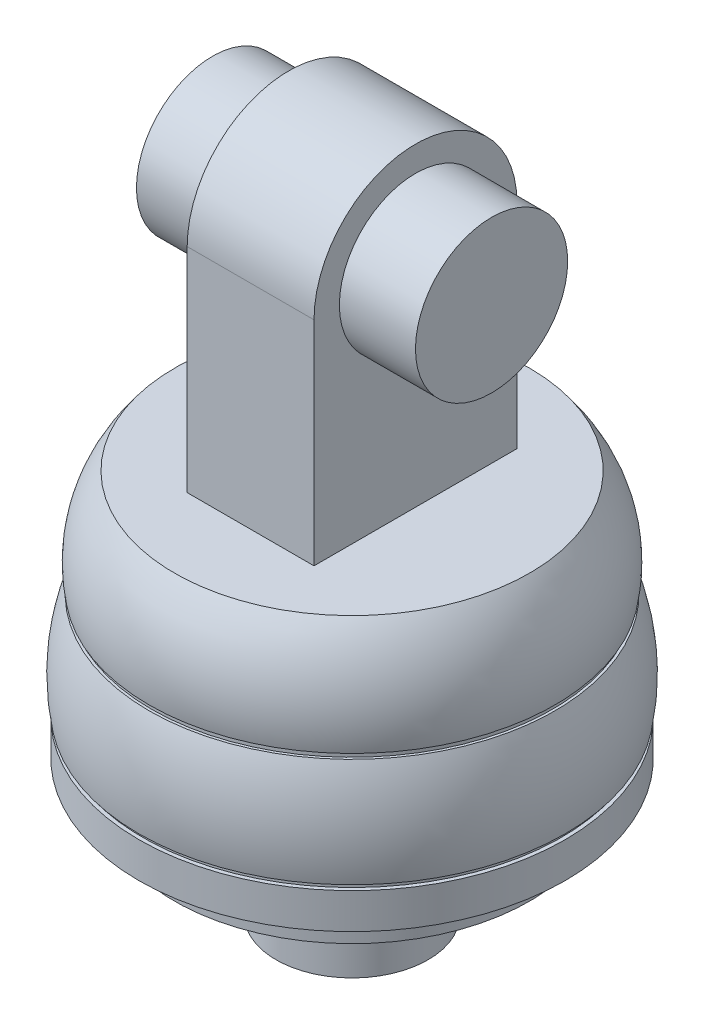
from build123d import *

# Parameters (mm, degrees)
SKETCH2_R           = 39.5
BOSS_EXTRUDE1_DEPTH = 1
SKETCH4_R           = 41.25
BOSS_EXTRUDE2_DEPTH = 1
SKETCH5_R           = 42
BOSS_EXTRUDE3_DEPTH = 7
SKETCH6_R           = 35
BOSS_EXTRUDE4_DEPTH = 7
SKETCH7_R           = 15
BOSS_EXTRUDE5_DEPTH = 20
SKETCH8_W           = 25
SKETCH8_H           = 40
BOSS_EXTRUDE6_DEPTH = 42
BOSS_EXTRUDE7_DEPTH = 12.5
SKETCH11_R          = 15
BOSS_EXTRUDE8_DEPTH = 15
SKETCH12_R          = 15
BOSS_EXTRUDE9_DEPTH = 15


with BuildPart() as part:
    # Sketch1 → Revolve1 (revolve)
    with BuildSketch(Plane.XY, mode=Mode.PRIVATE) as revolve1_sk:
        with BuildLine():
            Line((0, 0), (0, 20))
            Line((0, 20), (-35, 20))
            ThreePointArc((-35, 20), (-39.657515479, 10.53937887), (-40, 0))
            Line((-40, 0), (0, 0))
        make_face()
    revolve(revolve1_sk.sketch.rotate(Axis((0, 0, 0), (0, 1, 0)), 270), axis=Axis((0, 0, 0), (0, 1, 0)))

    # Sketch2 → Boss-Extrude1 (add)
    with BuildSketch(Plane.XZ):
        with Locations(Location((0, 0, 0), (0, 0, 270))):
            Circle(SKETCH2_R)
    extrude(amount=BOSS_EXTRUDE1_DEPTH)

    # Sketch3 → Revolve2 (revolve)
    with BuildSketch(Plane(origin=(0, 0, 0), x_dir=(0, 0, -1), z_dir=(1, 0, 0)), mode=Mode.PRIVATE) as revolve2_sk:
        with BuildLine():
            Line((-40, -1), (0, -1))
            Line((0, -1), (0, -21))
            Line((0, -21), (-42, -21))
            ThreePointArc((-42, -21), (-42.384109041, -10.861589096), (-40, -1))
        make_face()
    revolve(revolve2_sk.sketch.rotate(Axis((0, -1, 0), (0, -1, 0)), 180), axis=Axis((0, -1, 0), (0, -1, 0)))

    # Sketch4 → Boss-Extrude2 (add)
    with BuildSketch(Plane.XZ.offset(21)):
        with Locations(Location((0, 0, 0), (0, 0, 270))):
            Circle(SKETCH4_R)
    extrude(amount=BOSS_EXTRUDE2_DEPTH)

    # Sketch5 → Boss-Extrude3 (add)
    with BuildSketch(Plane.XZ.offset(22)):
        with Locations(Location((0, 0, 0), (0, 0, 270))):
            Circle(SKETCH5_R)
    extrude(amount=BOSS_EXTRUDE3_DEPTH)

    # Sketch6 → Boss-Extrude4 (add)
    with BuildSketch(Plane.XZ.offset(29)):
        with Locations(Location((0, 0, 0), (0, 0, 270))):
            Circle(SKETCH6_R)
    extrude(amount=BOSS_EXTRUDE4_DEPTH)

    # Sketch7 → Boss-Extrude5 (add)
    with BuildSketch(Plane.XZ.offset(36)):
        with Locations(Location((0, 0, 0), (0, 0, 270))):
            Circle(SKETCH7_R)
    extrude(amount=BOSS_EXTRUDE5_DEPTH)

    # Sketch8 → Boss-Extrude6 (add)
    with BuildSketch(Plane(origin=(0, 20, 0), x_dir=(1, 0, 0), z_dir=(0, 1, 0))):
        Rectangle(SKETCH8_W, SKETCH8_H)
    extrude(amount=BOSS_EXTRUDE6_DEPTH)

    # Sketch10 → Boss-Extrude7 (add, symmetric)
    with BuildSketch(Plane(origin=(0, 0, 0), x_dir=(0, 0, -1), z_dir=(1, 0, 0))):
        with BuildLine():
            Line((20, 62), (-20, 62))
            ThreePointArc((-20, 62), (0, 82), (20, 62))
        make_face()
    extrude(amount=BOSS_EXTRUDE7_DEPTH, both=True)

    # Sketch12 → Boss-Extrude9 (add)
    with BuildSketch(Plane(origin=(12.5, 0, 0), x_dir=(0, 0, -1), z_dir=(1, 0, 0))):
        with Locations(Location((0, 62, 0), (0, 0, 180))):
            Circle(SKETCH12_R)
    extrude(amount=BOSS_EXTRUDE9_DEPTH)


with BuildPart() as body_2:
    # Sketch11 → Boss-Extrude8 (new body)
    with BuildSketch(Plane.ZY.offset(12.5)):
        with Locations((0, 62)):
            Circle(SKETCH11_R)
    extrude(amount=BOSS_EXTRUDE8_DEPTH)


solid = Compound([part.part, body_2.part])
